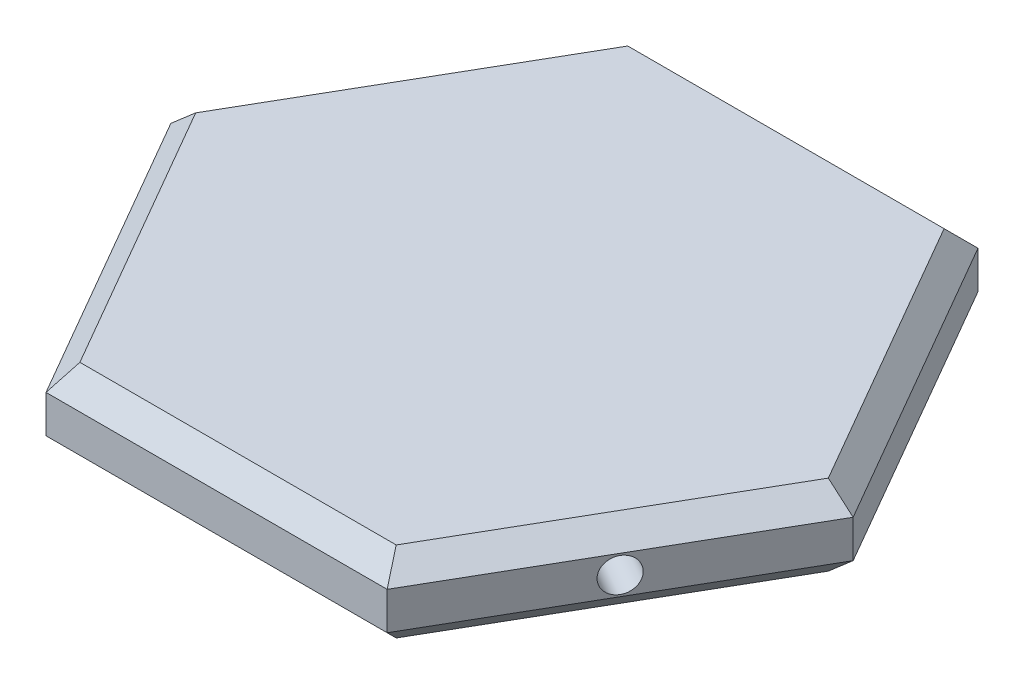
from build123d import *

# Parameters (mm, degrees)
BOSS_EXTRUDE1_DEPTH = 19.05
CHAMFER1_SIZE       = 5.08
SKETCH2_R           = 4
CUT_EXTRUDE1_DEPTH  = 12.7
CIRPATTERN1_COUNT   = 3


with BuildPart() as part:
    # Sketch1 → Boss-Extrude1 (new body)
    with BuildSketch(Plane(origin=(0, 0, 0), x_dir=(1, 0, 0), z_dir=(0, 1, 0))):
        Polygon((40.327916303, -69.85), (80.655832606, 0), (40.327916303, 69.85), (-40.327916303, 69.85), (-80.655832606, 0), (-40.327916303, -69.85), align=None)
    extrude(amount=BOSS_EXTRUDE1_DEPTH)

    # Chamfer1
    chamfer1_edges = [part.edges().sort_by_distance(p)[0] for p in [
        (60.491874454, 19.05, -34.925),
        (0, 19.05, -69.85),
        (-60.491874454, 19.05, -34.925),
        (-60.491874454, 19.05, 34.925),
        (0, 19.05, 69.85),
        (-60.491874454, 0, 34.925),
        (-60.491874454, 0, -34.925),
        (0, 0, -69.85),
        (60.491874454, 0, -34.925),
        (60.491874454, 0, 34.925),
        (0, 0, 69.85),
        (60.491874454, 19.05, 34.925),
    ]]
    chamfer(chamfer1_edges, length=CHAMFER1_SIZE)

    # Sketch2 → Cut-Extrude1 (cut)
    with BuildSketch(Plane(origin=(-60.491874454, 0, 34.925), x_dir=(0.5000000000000001, 0, 0.8660254037844386), z_dir=(-0.8660254037844386, 0, 0.5000000000000001))):
        with Locations((0, 9.525)):
            Circle(SKETCH2_R)
    cut_extrude1 = extrude(amount=-CUT_EXTRUDE1_DEPTH, mode=Mode.SUBTRACT)

    # CirPattern1: Cut-Extrude1 ×3 about axis
    cirpattern1_axis = Axis((0, 0, 0), (0, 1, 0))
    for i in range(1, CIRPATTERN1_COUNT):
        add(cut_extrude1.rotate(cirpattern1_axis, i * 360 / CIRPATTERN1_COUNT), mode=Mode.SUBTRACT)


solid = part.part
